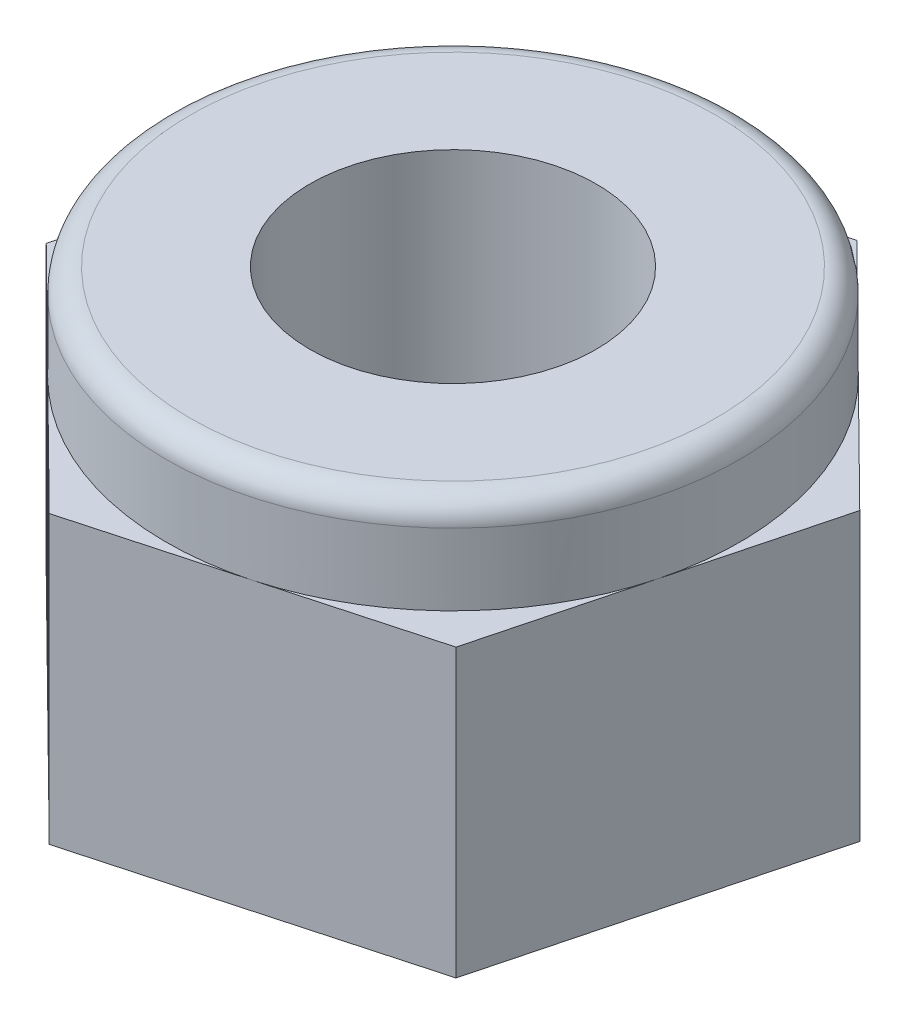
from build123d import *

# Parameters (mm, degrees)
BOSS_EXTRUDE1_DEPTH = 3
SKETCH3_R           = 3
BOSS_EXTRUDE2_DEPTH = 1
CUT_EXTRUDE1_REACH  = 8.196
SKETCH4_R           = 1.5
FILLET1_R           = 0.25


with BuildPart() as part:
    # Sketch1 → Boss-Extrude1 (new body)
    with BuildSketch(Plane(origin=(0, 0, 0), x_dir=(1, 0, 0), z_dir=(0, 1, 0))):
        Polygon((2.465199296, -2.433678786), (3.340227301, 0.918085822), (0.875028005, 3.351764608), (-2.465199296, 2.433678786), (-3.340227301, -0.918085822), (-0.875028005, -3.351764608), align=None)
    extrude(amount=BOSS_EXTRUDE1_DEPTH)

    # Sketch3 → Boss-Extrude2 (add)
    with BuildSketch(Plane(origin=(0, 3, 0), x_dir=(1, 0, 0), z_dir=(0, 1, 0))):
        Circle(SKETCH3_R)
    extrude(amount=BOSS_EXTRUDE2_DEPTH)

    # Sketch4 → Cut-Extrude1 (cut, up to next)
    with BuildSketch(Plane(origin=(0, 4, 0), x_dir=(1, 0, 0), z_dir=(0, 1, 0)), mode=Mode.PRIVATE) as cut_extrude1_sk1:
        Circle(SKETCH4_R)
    cut_extrude1_tool1 = extrude(cut_extrude1_sk1.sketch, amount=-CUT_EXTRUDE1_REACH, mode=Mode.PRIVATE) & part.part
    add(cut_extrude1_tool1.solids().sort_by_distance((0, 4, 0))[0], mode=Mode.SUBTRACT)

    # Fillet1
    fillet1_edges = [part.edges().sort_by_distance(p)[0] for p in [
        (-3, 4, 0),
    ]]
    fillet(fillet1_edges, radius=FILLET1_R)


solid = part.part
